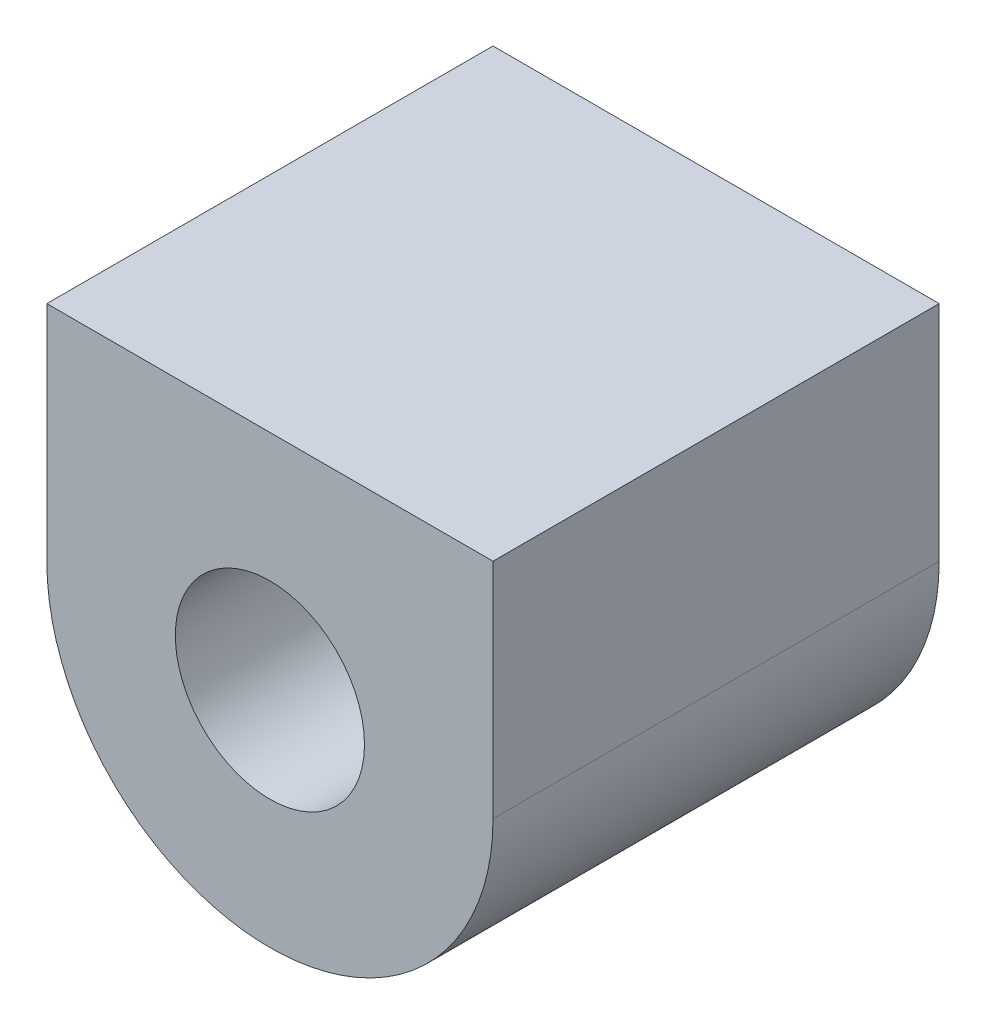
from build123d import *

# Parameters (mm, degrees)
SKETCH1_W           = 25
SKETCH1_H           = 25
BOSS_EXTRUDE1_DEPTH = 25
SKETCH2_R           = 5.3
CUT_EXTRUDE1_DEPTH  = 38.5
FILLET1_RADIUS      = 12.5
FILLET1_LENGTH      = 25


with BuildPart() as part:
    # Sketch1 → Boss-Extrude1 (new body)
    with BuildSketch(Plane(origin=(0, 0, 0), x_dir=(1, 0, 0), z_dir=(0, 1, 0))):
        Rectangle(SKETCH1_W, SKETCH1_H)
    extrude(amount=BOSS_EXTRUDE1_DEPTH)

    # Sketch2 → Cut-Extrude1 (cut, through all)
    with BuildSketch(Plane.XY.offset(12.5)):
        with Locations((0, 12.5)):
            Circle(SKETCH2_R)
    extrude(amount=-CUT_EXTRUDE1_DEPTH, mode=Mode.SUBTRACT)

    # Fillet1: full round fillet: the end face becomes a half cylinder, R = half its width
    fillet1_face = Plane((0, 0, 0), x_dir=(0, 0, -1), z_dir=(0, -1, 0))  # on the end face: x along it, z out of the body
    fillet1_slab = fillet1_face.offset(-FILLET1_RADIUS / 2) * Box(FILLET1_LENGTH, 2 * FILLET1_RADIUS, FILLET1_RADIUS, mode=Mode.PRIVATE)  # the body's end, R deep
    fillet1_round = Plane((0, 12.5, 0), x_dir=(0, -1, 0), z_dir=(0, 0, -1)) * Cylinder(FILLET1_RADIUS, FILLET1_LENGTH, mode=Mode.PRIVATE)  # its axis R under the face
    add(fillet1_slab - fillet1_round, mode=Mode.SUBTRACT)


solid = part.part
